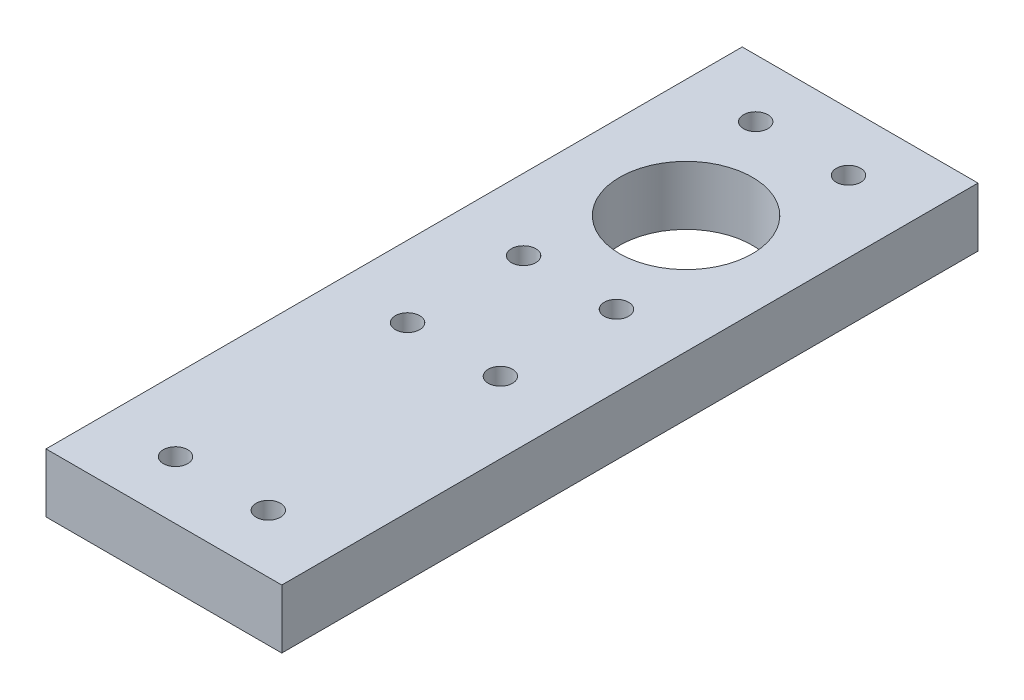
from build123d import *

# Parameters (mm, degrees)
SKETCH2_W           = 101.6
SKETCH2_H           = 300
BOSS_EXTRUDE1_DEPTH = 25.4
SKETCH3_R           = 5.25
SKETCH3_R_2         = 28.575
CUT_EXTRUDE1_DEPTH  = 25.4
SKETCH4_R           = 5.25
CUT_EXTRUDE2_DEPTH  = 25.4


with BuildPart() as part:
    # Sketch2 → Boss-Extrude1 (new body)
    with BuildSketch(Plane(origin=(0, 0, 0), x_dir=(1, 0, 0), z_dir=(0, 1, 0))):
        with Locations((50.8, 150)):
            Rectangle(SKETCH2_W, SKETCH2_H)
    extrude(amount=BOSS_EXTRUDE1_DEPTH)

    # Sketch3 → Cut-Extrude1 (cut)
    with BuildSketch(Plane(origin=(0, 25.4, 0), x_dir=(1, 0, 0), z_dir=(0, 1, 0))):
        with Locations(Location((70.8, 275, 0), (0, 0, 270))):
            Circle(SKETCH3_R)
        with Locations(Location((30.8, 275, 0), (0, 0, 270))):
            Circle(SKETCH3_R)
        with Locations(Location((70.8, 175, 0), (0, 0, 270))):
            Circle(SKETCH3_R)
        with Locations(Location((30.8, 175, 0), (0, 0, 270))):
            Circle(SKETCH3_R)
        with Locations(Location((50.8, 225, 0), (0, 0, 270))):
            Circle(SKETCH3_R_2)
    extrude(amount=-CUT_EXTRUDE1_DEPTH, mode=Mode.SUBTRACT)

    # Sketch4 → Cut-Extrude2 (cut)
    with BuildSketch(Plane(origin=(0, 25.4, 0), x_dir=(1, 0, 0), z_dir=(0, 1, 0))):
        with Locations(Location((70.8, 125, 0), (0, 0, 270))):
            Circle(SKETCH4_R)
        with Locations(Location((30.8, 125, 0), (0, 0, 270))):
            Circle(SKETCH4_R)
        with Locations(Location((30.8, 25, 0), (0, 0, 270))):
            Circle(SKETCH4_R)
        with Locations(Location((70.8, 25, 0), (0, 0, 270))):
            Circle(SKETCH4_R)
    extrude(amount=-CUT_EXTRUDE2_DEPTH, mode=Mode.SUBTRACT)


solid = part.part
